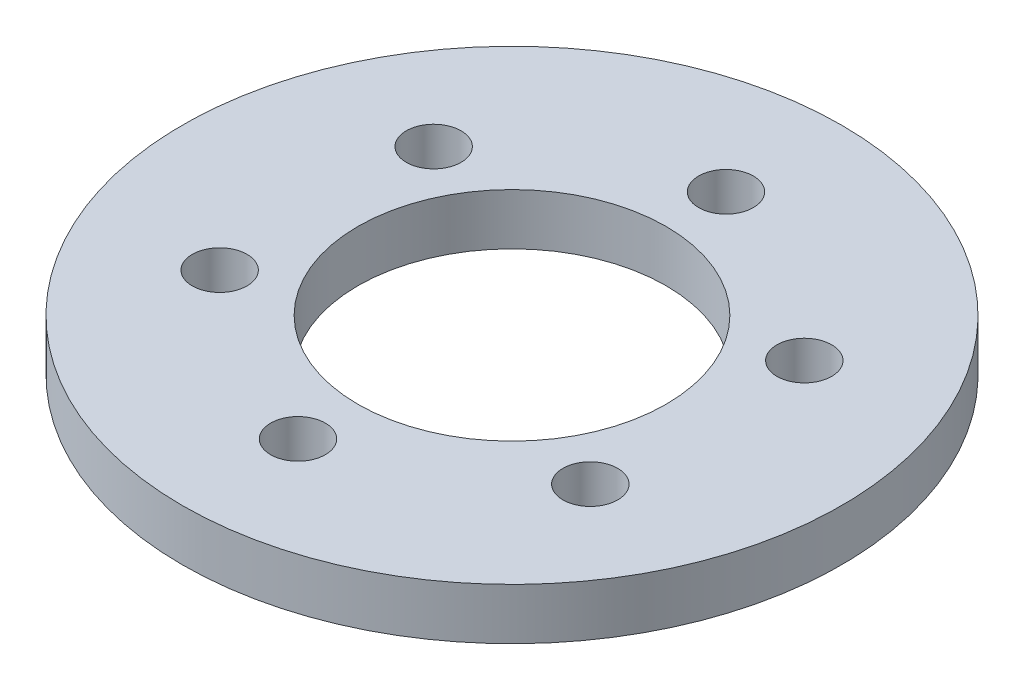
from build123d import *

# Parameters (mm, degrees)
SKETCH1_R           = 19.25
SKETCH1_R_2         = 9
SKETCH1_R_3         = 1.6
BOSS_EXTRUDE1_DEPTH = 3


with BuildPart() as part:
    # Sketch1 → Boss-Extrude1 (new body)
    with BuildSketch(Plane(origin=(0, 0, 0), x_dir=(1, 0, 0), z_dir=(0, 1, 0))):
        with Locations(Location((0, 0, 0), (0, 0, 270))):
            Circle(SKETCH1_R)
        with Locations(Location((0, 0, 0), (0, 0, 270))):
            Circle(SKETCH1_R_2, mode=Mode.SUBTRACT)
        with Locations(Location((0, 12.5, 0), (0, 0, 270))):
            Circle(SKETCH1_R_3, mode=Mode.SUBTRACT)
        with Locations(Location((10.825317547, 6.25, 0), (0, 0, 270))):
            Circle(SKETCH1_R_3, mode=Mode.SUBTRACT)
        with Locations(Location((10.825317547, -6.25, 0), (0, 0, 270))):
            Circle(SKETCH1_R_3, mode=Mode.SUBTRACT)
        with Locations(Location((0, -12.5, 0), (0, 0, 270))):
            Circle(SKETCH1_R_3, mode=Mode.SUBTRACT)
        with Locations(Location((-10.825317547, -6.25, 0), (0, 0, 270))):
            Circle(SKETCH1_R_3, mode=Mode.SUBTRACT)
        with Locations(Location((-10.825317547, 6.25, 0), (0, 0, 270))):
            Circle(SKETCH1_R_3, mode=Mode.SUBTRACT)
    extrude(amount=BOSS_EXTRUDE1_DEPTH)


solid = part.part
